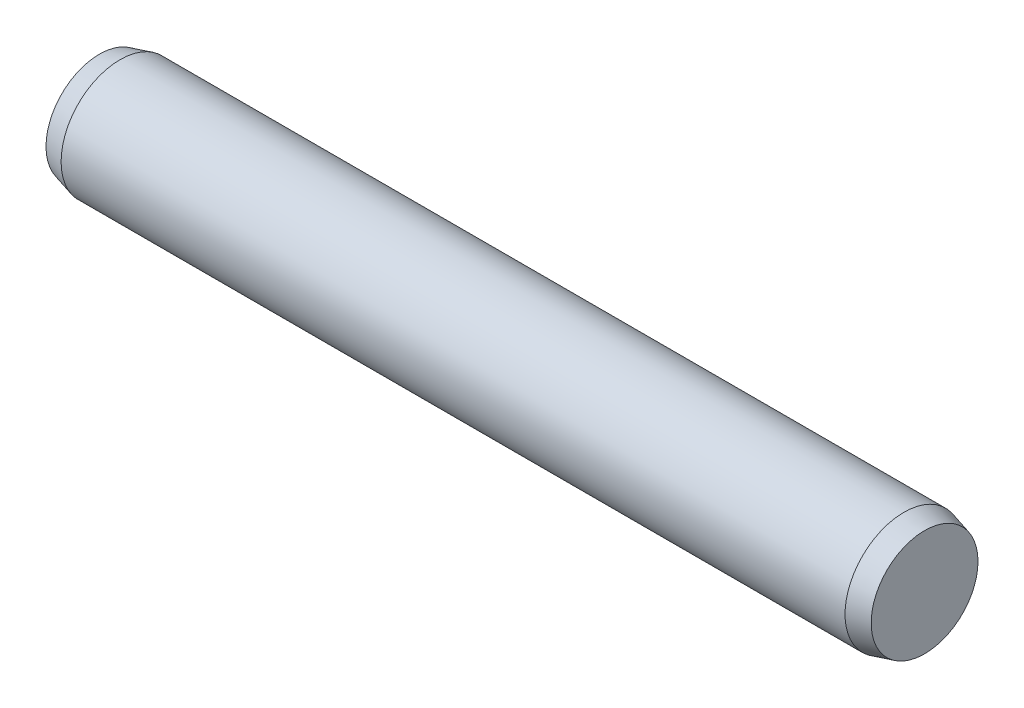
from build123d import *

# Parameters (mm, degrees)
EXTRUDE1_DEPTH      = 6.65
EXTRUDE1_DEPTH_BACK = 6.65
SKETCH2_R           = 1
SKETCH3_R           = 1
EXTRUDE2_DEPTH      = 0.35
EXTRUDE2_TAPER      = 15
SKETCH4_R           = 1
EXTRUDE3_DEPTH      = 0.35
EXTRUDE3_TAPER      = 15


with BuildPart() as part:
    # Sketch2 → Extrude1 (new, two sides: drawn at the far end of the back side and taken through both)
    with BuildSketch(Plane(origin=(0, 0, 0), x_dir=(0, 0, -1), z_dir=(1, 0, 0)).offset(-EXTRUDE1_DEPTH_BACK)):
        Circle(SKETCH2_R)
    extrude(amount=EXTRUDE1_DEPTH + EXTRUDE1_DEPTH_BACK)

    # Sketch3 → Extrude2 (add)
    with BuildSketch(Plane(origin=(6.65, 0, 0), x_dir=(0, 0, -1), z_dir=(1, 0, 0))):
        Circle(SKETCH3_R)
    extrude(amount=EXTRUDE2_DEPTH, taper=EXTRUDE2_TAPER)

    # Sketch4 → Extrude3 (add)
    with BuildSketch(Plane.ZY.offset(6.65)):
        with Locations(Location((0, 0, 0), (0, 0, 180))):
            Circle(SKETCH4_R)
    extrude(amount=EXTRUDE3_DEPTH, taper=EXTRUDE3_TAPER)


solid = part.part
